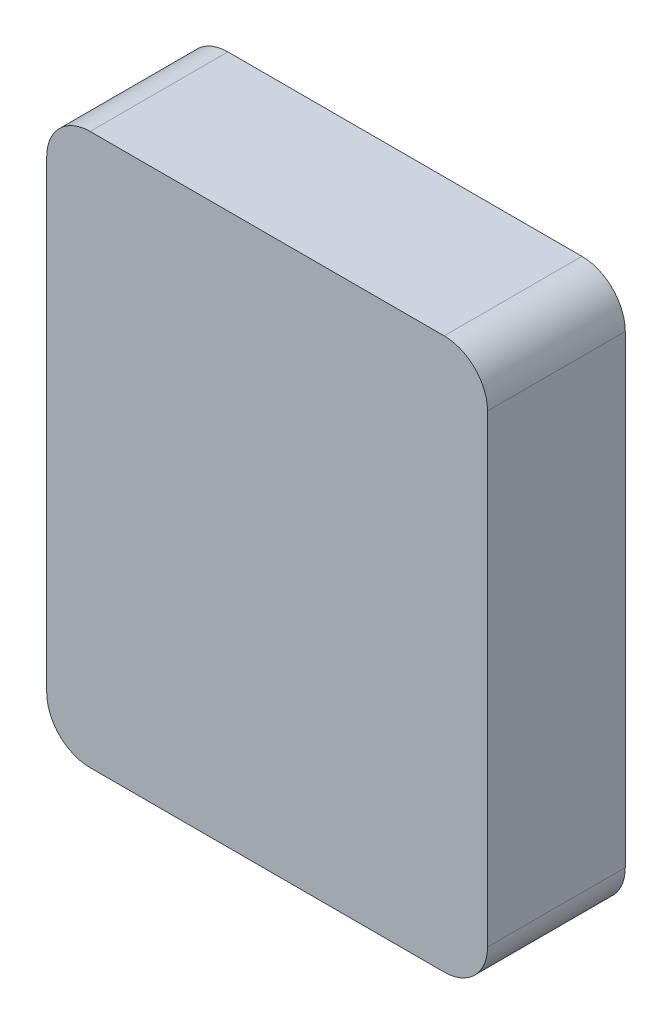
from build123d import *

# Parameters (mm, degrees)
SKETCH1_W           = 101.6
SKETCH1_H           = 127
BOSS_EXTRUDE1_DEPTH = 31.75
FILLET1_R           = 10


with BuildPart() as part:
    # Sketch1 → Boss-Extrude1 (new body)
    with BuildSketch(Plane.XY):
        with Locations((50.8, 63.5)):
            Rectangle(SKETCH1_W, SKETCH1_H)
    extrude(amount=BOSS_EXTRUDE1_DEPTH)

    # Fillet1
    fillet1_edges = [part.edges().sort_by_distance(p)[0] for p in [
        (0, 127, 15.875),
        (101.6, 127, 15.875),
        (101.6, 0, 15.875),
        (0, 0, 15.875),
    ]]
    fillet(fillet1_edges, radius=FILLET1_R)


solid = part.part
